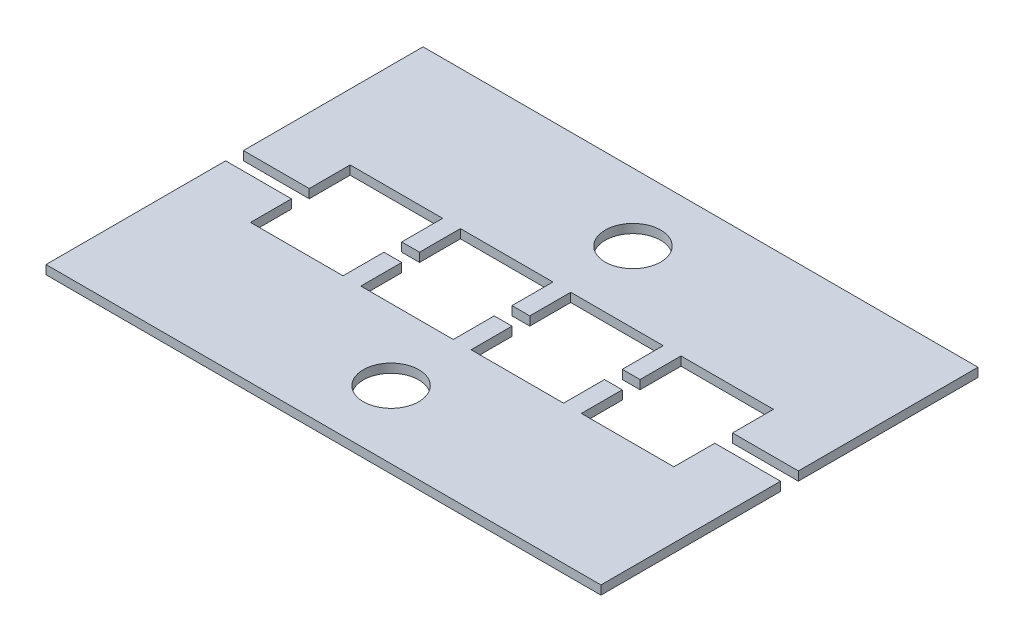
from build123d import *

# Parameters (mm, degrees)
SKETCH2_R             = 1.9812
BOSS_EXTRUDE1_DEPTH   = 0.635
BOSS_EXTRUDE1_2_DEPTH = 0.635


with BuildPart() as part:
    # Sketch2 → Boss-Extrude1 (new body)
    with BuildSketch(Plane(origin=(0, 0, 0), x_dir=(1, 0, 0), z_dir=(0, 1, 0))):
        Polygon((-19.812, 13.462), (-19.812, 0.635), (-15.113, 0.635), (-15.113, 3.556), (-8.509, 3.556), (-8.509, 0.635), (-7.239, 0.635), (-7.239, 3.556), (-0.635, 3.556), (-0.635, 0.635), (0.635, 0.635), (0.635, 3.556), (7.239, 3.556), (7.239, 0.635), (8.509, 0.635), (8.509, 3.556), (15.113, 3.556), (15.113, 0.635), (19.812, 0.635), (19.812, 13.462), align=None)
        with Locations(Location((0, 8.636, 0), (0, 0, 270))):
            Circle(SKETCH2_R, mode=Mode.SUBTRACT)
    extrude(amount=BOSS_EXTRUDE1_DEPTH)


with BuildPart() as body_2:
    # Sketch2 → Boss-Extrude1 2 (new body)
    with BuildSketch(Plane(origin=(0, 0, 0), x_dir=(1, 0, 0), z_dir=(0, 1, 0))):
        Polygon((-15.113, -0.635), (-19.812, -0.635), (-19.812, -13.462), (19.812, -13.462), (19.812, -0.635), (15.113, -0.635), (15.113, -3.556), (8.509, -3.556), (8.509, -0.635), (7.239, -0.635), (7.239, -3.556), (0.635, -3.556), (0.635, -0.635), (-0.635, -0.635), (-0.635, -3.556), (-7.239, -3.556), (-7.239, -0.635), (-8.509, -0.635), (-8.509, -3.556), (-15.113, -3.556), align=None)
        with Locations(Location((0, -8.636, 0), (0, 0, 270))):
            Circle(SKETCH2_R, mode=Mode.SUBTRACT)
    extrude(amount=BOSS_EXTRUDE1_2_DEPTH)


solid = Compound([part.part, body_2.part])
